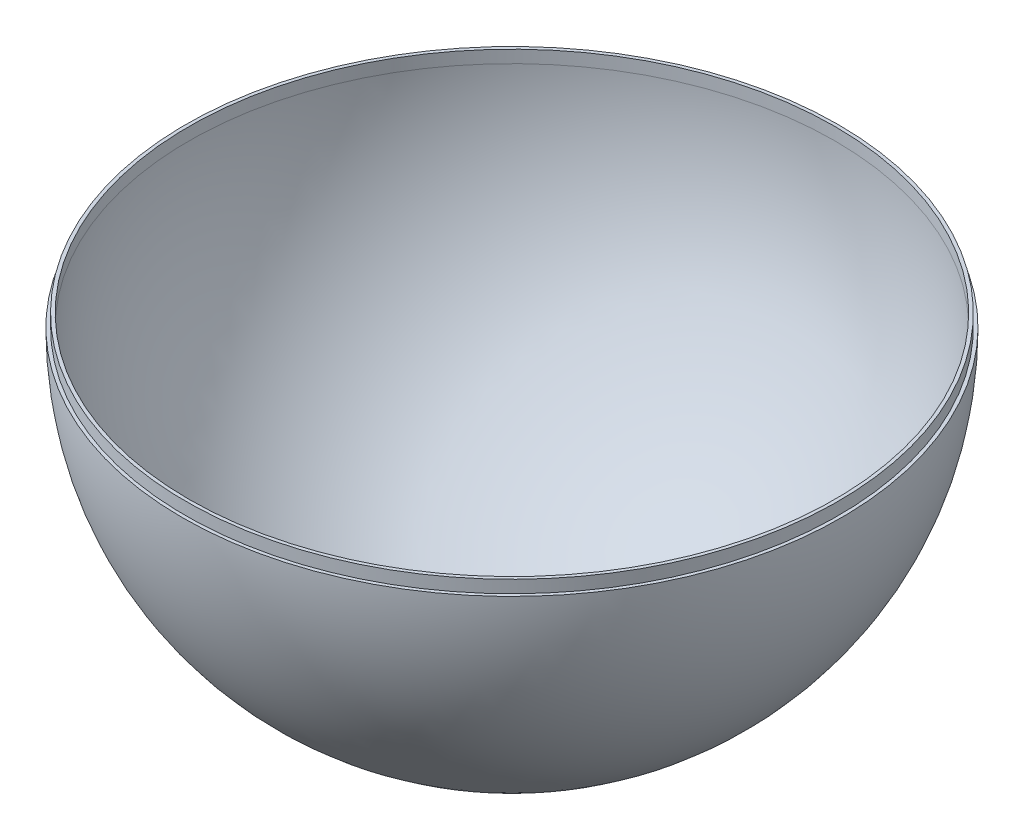
from build123d import *

# Parameters (mm, degrees)
SHELL1_T            = 2
SKETCH2_R           = 125.720178412
CUT_EXTRUDE1_DEPTH  = 156
SKETCH3_R           = 99
SKETCH3_R_2         = 98
BOSS_EXTRUDE1_DEPTH = 3.8


with BuildPart() as part:
    # Sketch1 → Revolve1 (revolve)
    with BuildSketch(Plane(origin=(0, 0, 0), x_dir=(1, 0, 0), z_dir=(0, 1, 0))):
        with BuildLine():
            Line((0, 100), (0, -100))
            ThreePointArc((0, -100), (100, 0), (0, 100))
        make_face()
    revolve(axis=Axis((0, 0, -100), (0, 0, 1)))

    # Shell1 (no face opened: a closed hollow body)
    add(offset(amount=-SHELL1_T, mode=Mode.PRIVATE), mode=Mode.SUBTRACT)

    # Sketch2 → Cut-Extrude1 (cut)
    with BuildSketch(Plane(origin=(0, 0, 0), x_dir=(1, 0, 0), z_dir=(0, 1, 0))):
        Circle(SKETCH2_R)
    extrude(amount=CUT_EXTRUDE1_DEPTH, mode=Mode.SUBTRACT)

    # Sketch3 → Boss-Extrude1 (add)
    with BuildSketch(Plane(origin=(0, 0, 0), x_dir=(1, 0, 0), z_dir=(0, 1, 0))):
        with Locations(Location((0, 0, 0), (0, 0, 90))):
            Circle(SKETCH3_R)
        with Locations(Location((0, 0, 0), (0, 0, 90))):
            Circle(SKETCH3_R_2, mode=Mode.SUBTRACT)
    extrude(amount=BOSS_EXTRUDE1_DEPTH)


solid = part.part
